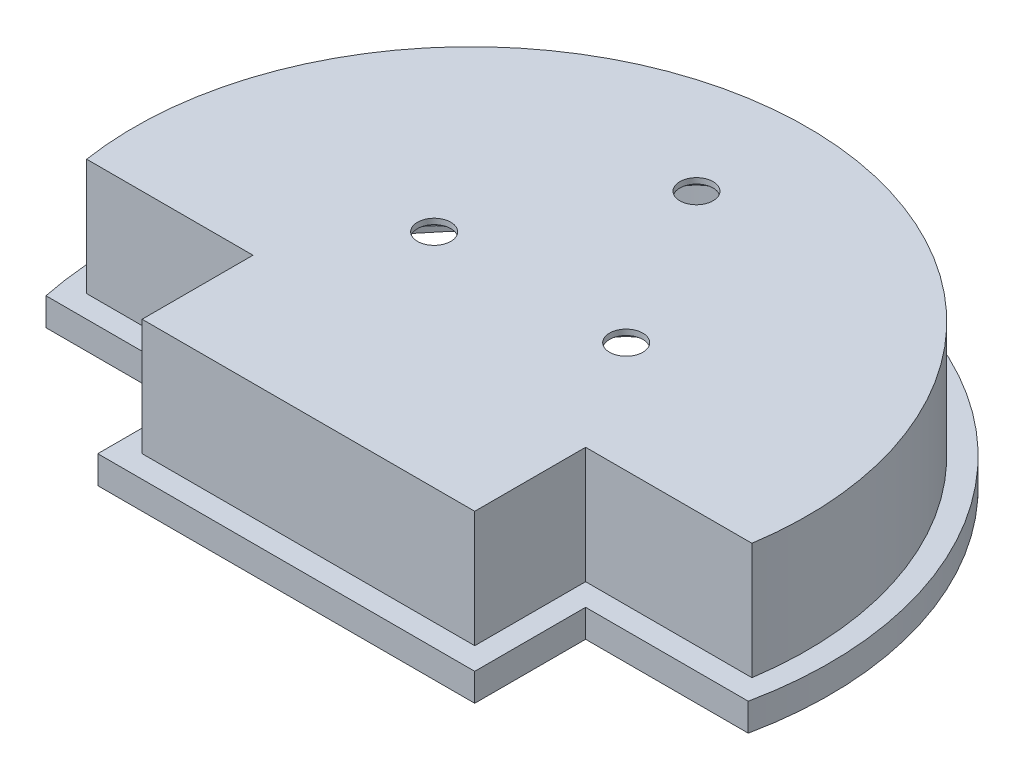
from build123d import *

# Parameters (mm, degrees)
EXTRUIR_L_MINA1_DEPTH   = 11
SALIENTE_EXTRUIR1_DEPTH = 2
CROQUIS3_R              = 3.5
CORTAR_EXTRUIR2_DEPTH   = 1.5
SALIENTE_EXTRUIR3_DEPTH = 2.5
CROQUIS5_R              = 1.5
CORTAR_EXTRUIR3_DEPTH   = 10


with BuildPart() as part:
    # Croquis1 → Extruir-Lámina1 (new body)
    with BuildSketch(Plane(origin=(0, 0, 0), x_dir=(1, 0, 0), z_dir=(0, 1, 0))):
        with BuildLine():
            Line((-30, 10), (-15, 10))
            Line((-15, 10), (-15, 0))
            Line((-15, 0), (15, 0))
            Line((15, 0), (15, 10))
            Line((15, 10), (30, 10))
            ThreePointArc((30, 10), (0, 45), (-30, 10))
        make_face()
        with BuildLine():
            Line((-28.233718443, 12), (-13, 12))
            Line((-13, 12), (-13, 2))
            Line((-13, 2), (13, 2))
            Line((13, 2), (13, 12))
            Line((13, 12), (28.233718443, 12))
            ThreePointArc((28.233718443, 12), (0, 43), (-28.233718443, 12))
        make_face(mode=Mode.SUBTRACT)
    extrude(amount=EXTRUIR_L_MINA1_DEPTH)

    # Croquis2 → Saliente-Extruir1 (add)
    with BuildSketch(Plane(origin=(0, 11, 0), x_dir=(1, 0, 0), z_dir=(0, 1, 0))):
        with BuildLine():
            Line((15, 10), (30, 10))
            ThreePointArc((30, 10), (0, 45), (-30, 10))
            Line((-30, 10), (-15, 10))
            Line((-15, 10), (-15, 0))
            Line((-15, 0), (15, 0))
            Line((15, 0), (15, 10))
        make_face()
    extrude(amount=SALIENTE_EXTRUIR1_DEPTH)

    # Croquis3 → Cortar-Extruir2 (cut)
    with BuildSketch(Plane.XZ.offset(-11)):
        with Locations(Location((-8.660254038, -20, 0), (0, 0, 270))):
            Circle(CROQUIS3_R)
        with Locations(Location((8.660254038, -20, 0), (0, 0, 270))):
            Circle(CROQUIS3_R)
        with Locations(Location((0, -35, 0), (0, 0, 270))):
            Circle(CROQUIS3_R)
    extrude(amount=-CORTAR_EXTRUIR2_DEPTH, mode=Mode.SUBTRACT)

    # Croquis4 → Saliente-Extruir3 (add)
    with BuildSketch(Plane.XZ):
        with BuildLine():
            Line((17, 2), (-17, 2))
            Line((-17, 2), (-17, -8))
            Line((-17, -8), (-31.667919775, -8))
            ThreePointArc((-31.667919775, -8), (0, -47), (31.667919775, -8))
            Line((31.667919775, -8), (17, -8))
            Line((17, -8), (17, 2))
        make_face()
        with BuildLine():
            Line((13, -12), (28.233718443, -12))
            ThreePointArc((28.233718443, -12), (0, -43), (-28.233718443, -12))
            Line((-28.233718443, -12), (-13, -12))
            Line((-13, -12), (-13, -2))
            Line((-13, -2), (13, -2))
            Line((13, -2), (13, -12))
        make_face(mode=Mode.SUBTRACT)
    extrude(amount=-SALIENTE_EXTRUIR3_DEPTH)

    # Croquis5 → Cortar-Extruir3 (cut)
    with BuildSketch(Plane.XZ.offset(-11)):
        with Locations(Location((-8.660254038, -20, 0), (0, 0, 270))):
            Circle(CROQUIS5_R)
        with Locations(Location((8.660254038, -20, 0), (0, 0, 270))):
            Circle(CROQUIS5_R)
        with Locations(Location((0, -35, 0), (0, 0, 270))):
            Circle(CROQUIS5_R)
    extrude(amount=-CORTAR_EXTRUIR3_DEPTH, mode=Mode.SUBTRACT)


solid = part.part
